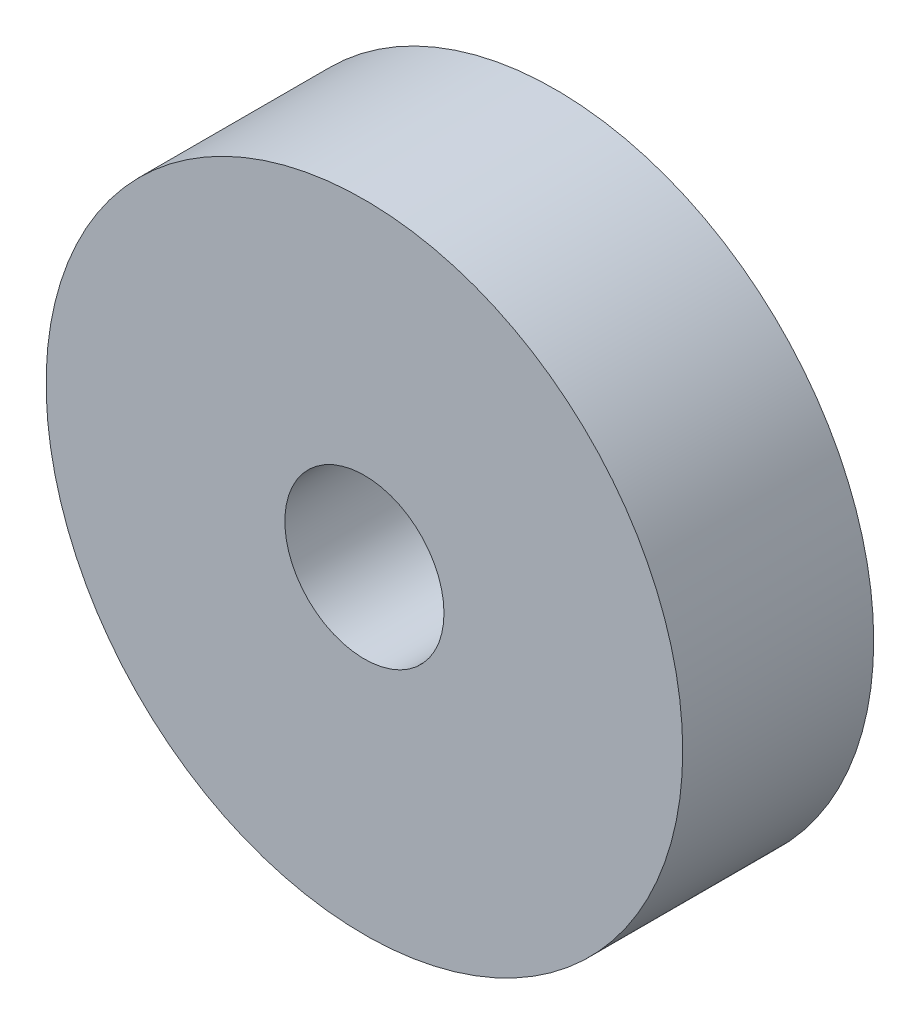
from build123d import *

# Parameters (mm, degrees)
SKETCH1_R           = 10
SKETCH1_R_2         = 2.5
BOSS_EXTRUDE1_DEPTH = 6


with BuildPart() as part:
    # Sketch1 → Boss-Extrude1 (new body)
    with BuildSketch(Plane.XY):
        Circle(SKETCH1_R)
        Circle(SKETCH1_R_2, mode=Mode.SUBTRACT)
    extrude(amount=BOSS_EXTRUDE1_DEPTH)


solid = part.part
